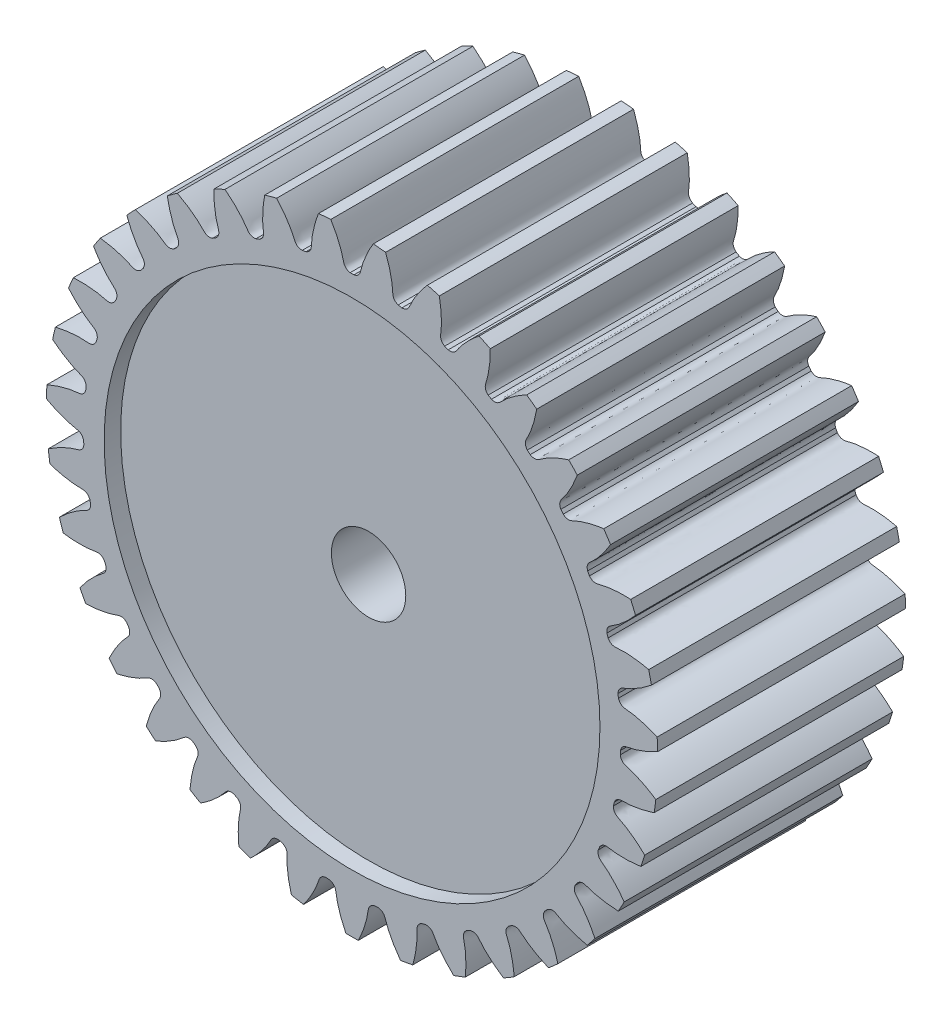
from build123d import *

# Parameters (mm, degrees)
SKETCH_1_R               = 37
EXTRUDE_1_DEPTH          = 30
CUT_EXTRUDE_1_DEPTH      = 61.3158354
PATTERN_CIRCULAR_1_COUNT = 35
SKETCH_4_R               = 4.5
CUT_EXTRUDE_2_DEPTH      = 61.308962652
SKETCH_5_R               = 30
CUT_EXTRUDE_3_DEPTH      = 2
CUT_EXTRUDE_START        = -2
SKETCH_6_R               = 30
CUT_EXTRUDE_4_DEPTH      = 2


with BuildPart() as part:
    # 草图1 → 凸台-拉伸1 (new body)
    with BuildSketch(Plane.XY):
        Circle(SKETCH_1_R)
    extrude(amount=EXTRUDE_1_DEPTH)

    # 草图2 → 切除-拉伸1 (cut, through all)
    with BuildSketch(Plane.XY):
        with BuildLine():
            ThreePointArc((0.23205795, 32.499171514), (0, 32.5), (-0.23205795, 32.499171514))
            add(Edge.make_bspline(
                [(-0.23205795, 32.499171514), (-0.948237184, 32.653498363), (-1.002389404, 33.176600876), (-1.144209214, 33.728887212), (-1.186142728, 33.880728489), (-1.23493681, 34.044274955), (-1.290975053, 34.219354894), (-1.354766726, 34.405724817), (-1.42677514, 34.603143881), (-1.5074686, 34.811351789), (-1.597304749, 35.030075589), (-1.696734701, 35.259027902), (-1.806201341, 35.497907693), (-1.926139338, 35.746400304), (-2.056974673, 36.004177723), (-2.199124307, 36.270898784), (-2.35299582, 36.546209409), (-2.518987063, 36.829742844), (-2.697485814, 37.121119913), (-2.888869444, 37.419949269), (-3.093504584, 37.725827667), (-3.311746802, 38.038340236), (-3.543940286, 38.35706076), (-3.790417535, 38.681551975), (-4.051499051, 39.011365859), (-4.32749305, 39.346043947), (-4.618695168, 39.685117641), (-4.925388185, 40.02810853), (-5.247841742, 40.374528721), (-5.586312111, 40.723881173), (-5.941041811, 41.075660044), (-6.442349262, 41.553298257), (-6.833993641, 41.904390138), (-7.102868655, 42.136131648)],
                knots=[0, 0, 0, 0, 0.117408504, 0.129436489, 0.142560655, 0.156781001, 0.172097528, 0.188510236, 0.206019124, 0.224624192, 0.244325441, 0.265122871, 0.287016481, 0.310006272, 0.334092243, 0.359274395, 0.385552727, 0.41292724, 0.441397933, 0.470964807, 0.501627862, 0.533387097, 0.566242513, 0.600194109, 0.635241885, 0.671385843, 0.70862598, 0.746962299, 0.786394798, 0.826923477, 0.868548337, 0.911269377, 1, 1, 1, 1], degree=3))
            ThreePointArc((-7.102868655, 42.136131648), (0, 42.730601837), (7.102868655, 42.136131648))
            add(Edge.make_bspline(
                [(0.23205795, 32.499171514), (0.948237184, 32.653498363), (1.002389404, 33.176600876), (1.144209214, 33.728887212), (1.186142728, 33.880728489), (1.23493681, 34.044274955), (1.290975053, 34.219354894), (1.354766726, 34.405724817), (1.42677514, 34.603143881), (1.5074686, 34.811351789), (1.597304749, 35.030075589), (1.696734701, 35.259027902), (1.806201341, 35.497907693), (1.926139338, 35.746400304), (2.056974673, 36.004177723), (2.199124307, 36.270898784), (2.35299582, 36.546209409), (2.518987063, 36.829742844), (2.697485814, 37.121119913), (2.888869444, 37.419949269), (3.093504584, 37.725827667), (3.311746802, 38.038340236), (3.543940286, 38.35706076), (3.790417535, 38.681551975), (4.051499051, 39.011365859), (4.32749305, 39.346043947), (4.618695168, 39.685117641), (4.925388185, 40.02810853), (5.247841742, 40.374528721), (5.586312111, 40.723881173), (5.941041811, 41.075660044), (6.442349262, 41.553298257), (6.833993641, 41.904390138), (7.102868655, 42.136131648)],
                knots=[0, 0, 0, 0, 0.117408504, 0.129436489, 0.142560655, 0.156781001, 0.172097528, 0.188510236, 0.206019124, 0.224624192, 0.244325441, 0.265122871, 0.287016481, 0.310006272, 0.334092243, 0.359274395, 0.385552727, 0.41292724, 0.441397933, 0.470964807, 0.501627862, 0.533387097, 0.566242513, 0.600194109, 0.635241885, 0.671385843, 0.70862598, 0.746962299, 0.786394798, 0.826923477, 0.868548337, 0.911269377, 1, 1, 1, 1], degree=3))
        make_face()
    cut_extrude_1 = extrude(amount=CUT_EXTRUDE_1_DEPTH, mode=Mode.SUBTRACT)

    # 阵列(圆周)1: 切除-拉伸1 ×35 about axis
    pattern_circular_1_axis = Axis((0, 0, 30), (0, 0, -1))
    for i in range(1, PATTERN_CIRCULAR_1_COUNT):
        add(cut_extrude_1.rotate(pattern_circular_1_axis, i * 360 / PATTERN_CIRCULAR_1_COUNT), mode=Mode.SUBTRACT)

    # 草图4 → 切除-拉伸2 (cut, through all)
    with BuildSketch(Plane.XY.offset(30)):
        Circle(SKETCH_4_R)
    extrude(amount=-CUT_EXTRUDE_2_DEPTH, mode=Mode.SUBTRACT)

    # 草图5 → 切除-拉伸3 (cut)
    with BuildSketch(Plane.XY.offset(30)):
        Circle(SKETCH_5_R)
    extrude(amount=-CUT_EXTRUDE_3_DEPTH, mode=Mode.SUBTRACT)

    # 草图6 → 切除-拉伸4 (cut)
    with BuildSketch(Plane(origin=(0, 0, 0), x_dir=(-1, 0, 0), z_dir=(0, 0, -1)).offset(CUT_EXTRUDE_START)):
        Circle(SKETCH_6_R)
    extrude(amount=CUT_EXTRUDE_4_DEPTH, mode=Mode.SUBTRACT)


solid = part.part
